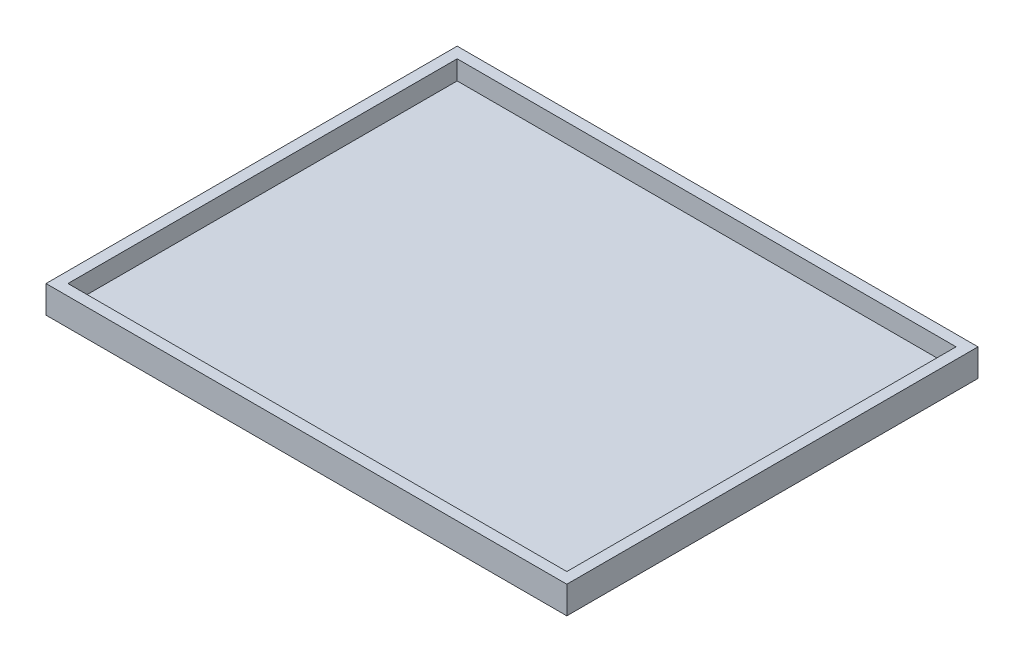
from build123d import *

# Parameters (mm, degrees)
SKETCH_6_W          = 95
SKETCH_6_H          = 75
EXTRUDE_1_DEPTH     = 5
SKETCH_7_W          = 91
SKETCH_7_H          = 71
CUT_EXTRUDE_1_DEPTH = 3.5


with BuildPart() as part:
    # 草图6 → 凸台-拉伸1 (new body)
    with BuildSketch(Plane(origin=(0, 0, 0), x_dir=(1, 0, 0), z_dir=(0, 1, 0))):
        with Locations((-55.733333333, 26.308333333)):
            Rectangle(SKETCH_6_W, SKETCH_6_H)
    extrude(amount=EXTRUDE_1_DEPTH)

    # 草图7 → 切除-拉伸1 (cut)
    with BuildSketch(Plane(origin=(0, 5, 0), x_dir=(1, 0, 0), z_dir=(0, 1, 0))):
        with Locations((-55.733333333, 26.308333333)):
            Rectangle(SKETCH_7_W, SKETCH_7_H)
    extrude(amount=-CUT_EXTRUDE_1_DEPTH, mode=Mode.SUBTRACT)


solid = part.part
